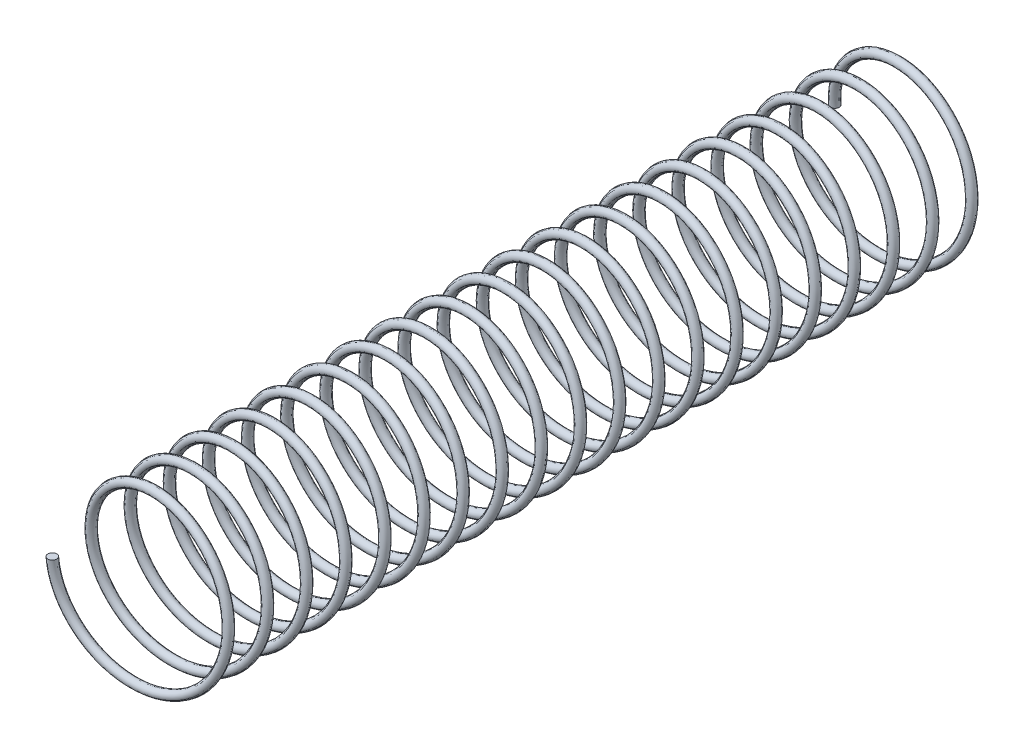
from build123d import *

# Parameters (mm, degrees)
SWEEP1_PITCH       = 1
SWEEP1_HEIGHT      = 20
SWEEP1_RADIUS      = 2
SWEEP1_START_ANGLE = -180
SKETCH8_R          = 0.114293109


with BuildPart() as part:
    # Sweep1: sweep along a helix
    with BuildLine() as sweep1_path:
        add(Helix(SWEEP1_PITCH, SWEEP1_HEIGHT, SWEEP1_RADIUS, center=(0, 0, 0), direction=(0, 0, 1), lefthand=True, mode=Mode.PRIVATE).rotate(Axis((0, 0, 0), (0, 0, 1)), SWEEP1_START_ANGLE))
    # Sketch8 → Sweep1 (sweep)
    with BuildSketch(Plane(origin=(0, 0, 0), x_dir=(1, 0, 0), z_dir=(0, 1, 0))):
        with Locations((-1.997543362, -19.992189225)):
            Circle(SKETCH8_R)
    sweep(path=sweep1_path.line, is_frenet=True)


solid = part.part
